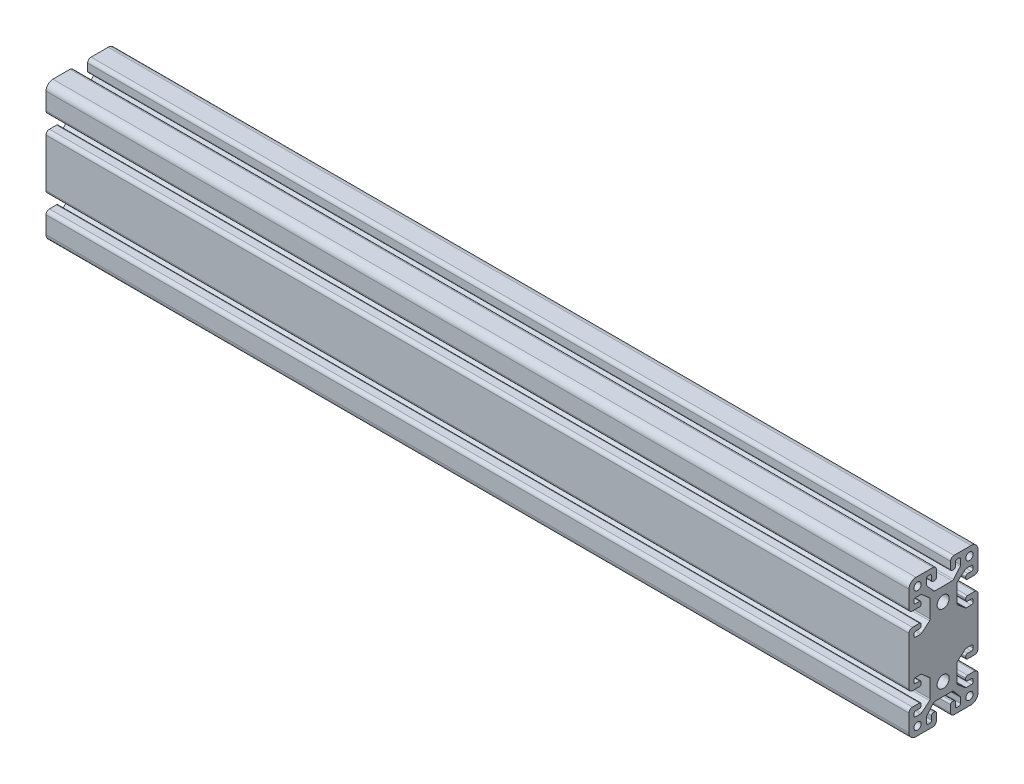
from build123d import *

# Parameters (mm, degrees)
SKETCH9_R                 = 3.5
SKETCH9_R_2               = 2.11
PERFIL80X40_80X40_1_DEPTH = 500


with BuildPart() as part:
    # Sketch9 → Perfil80x40 80X40(1) (new body)
    with BuildSketch(Plane.YZ):
        with BuildLine():
            Line((10.336613715, -12.811377082), (14.200412666, -8.24506923))
            ThreePointArc((14.200412666, -8.24506923), (14.543050952, -7.983833915), (14.963798951, -7.891011472))
            Line((14.963798951, -7.891011472), (25.036201049, -7.891011472))
            ThreePointArc((25.036201049, -7.891011472), (25.456949048, -7.983833915), (25.799587334, -8.24506923))
            Line((25.799587334, -8.24506923), (29.663386285, -12.811377082))
            ThreePointArc((29.663386285, -12.811377082), (29.838985166, -13.113361685), (29.9, -13.457319323))
            Line((29.9, -13.457319323), (29.9, -16.391011472))
            ThreePointArc((29.9, -16.391011472), (29.607106781, -17.098118253), (28.9, -17.391011472))
            Line((28.9, -17.391011472), (27.9, -17.391011472))
            ThreePointArc((27.9, -17.391011472), (27.192893219, -17.098118253), (26.9, -16.391011472))
            Line((26.9, -16.391011472), (26.9, -14.091011472))
            ThreePointArc((26.9, -14.091011472), (26.607106781, -13.383904691), (25.9, -13.091011472))
            Line((25.9, -13.091011472), (25.1, -13.091011472))
            ThreePointArc((25.1, -13.091011472), (24.392893219, -13.383904691), (24.1, -14.091011472))
            Line((24.1, -14.091011472), (24.1, -18.191011472))
            ThreePointArc((24.1, -18.191011472), (24.685786438, -19.605225034), (26.1, -20.191011472))
            Line((26.1, -20.191011472), (36, -20.191011472))
            ThreePointArc((36, -20.191011472), (38.828427125, -19.019438597), (40, -16.191011472))
            Line((40, -16.191011472), (40, -6.291011472))
            ThreePointArc((40, -6.291011472), (39.414213562, -4.87679791), (38, -4.291011472))
            Line((38, -4.291011472), (33.9, -4.291011472))
            ThreePointArc((33.9, -4.291011472), (33.192893219, -4.583904691), (32.9, -5.291011472))
            Line((32.9, -5.291011472), (32.9, -6.091011472))
            ThreePointArc((32.9, -6.091011472), (33.192893219, -6.798118253), (33.9, -7.091011472))
            Line((33.9, -7.091011472), (36.2, -7.091011472))
            ThreePointArc((36.2, -7.091011472), (36.907106781, -7.383904691), (37.2, -8.091011472))
            Line((37.2, -8.091011472), (37.2, -9.091011472))
            ThreePointArc((37.2, -9.091011472), (36.907106781, -9.798118253), (36.2, -10.091011472))
            Line((36.2, -10.091011472), (33.266307851, -10.091011472))
            ThreePointArc((33.266307851, -10.091011472), (32.922350213, -10.029996638), (32.62036561, -9.854397757))
            Line((32.62036561, -9.854397757), (28.054057759, -5.990598806))
            ThreePointArc((28.054057759, -5.990598806), (27.792822443, -5.64796052), (27.7, -5.227212521))
            Line((27.7, -5.227212521), (27.7, 4.845189577))
            ThreePointArc((27.7, 4.845189577), (27.792822443, 5.265937577), (28.054057759, 5.608575862))
            Line((28.054057759, 5.608575862), (32.62036561, 9.472374813))
            ThreePointArc((32.62036561, 9.472374813), (32.922350213, 9.647973694), (33.266307851, 9.708988528))
            Line((33.266307851, 9.708988528), (36.2, 9.708988528))
            ThreePointArc((36.2, 9.708988528), (36.907106781, 9.416095309), (37.2, 8.708988528))
            Line((37.2, 8.708988528), (37.2, 7.708988528))
            ThreePointArc((37.2, 7.708988528), (36.907106781, 7.001881747), (36.2, 6.708988528))
            Line((36.2, 6.708988528), (33.9, 6.708988528))
            ThreePointArc((33.9, 6.708988528), (33.192893219, 6.416095309), (32.9, 5.708988528))
            Line((32.9, 5.708988528), (32.9, 4.908988528))
            ThreePointArc((32.9, 4.908988528), (33.192893219, 4.201881747), (33.9, 3.908988528))
            Line((33.9, 3.908988528), (38, 3.908988528))
            ThreePointArc((38, 3.908988528), (39.414213562, 4.494774966), (40, 5.908988528))
            Line((40, 5.908988528), (40, 15.808988528))
            ThreePointArc((40, 15.808988528), (38.828427125, 18.637415653), (36, 19.808988528))
            Line((36, 19.808988528), (26.1, 19.808988528))
            ThreePointArc((26.1, 19.808988528), (24.685786438, 19.22320209), (24.1, 17.808988528))
            Line((24.1, 17.808988528), (24.1, 13.708988528))
            ThreePointArc((24.1, 13.708988528), (24.392893219, 13.001881747), (25.1, 12.708988528))
            Line((25.1, 12.708988528), (25.9, 12.708988528))
            ThreePointArc((25.9, 12.708988528), (26.607106781, 13.001881747), (26.9, 13.708988528))
            Line((26.9, 13.708988528), (26.9, 16.008988528))
            ThreePointArc((26.9, 16.008988528), (27.192893219, 16.716095309), (27.9, 17.008988528))
            Line((27.9, 17.008988528), (28.9, 17.008988528))
            ThreePointArc((28.9, 17.008988528), (29.607106781, 16.716095309), (29.9, 16.008988528))
            Line((29.9, 16.008988528), (29.9, 13.075296379))
            ThreePointArc((29.9, 13.075296379), (29.838985166, 12.731338741), (29.663386285, 12.429354138))
            Line((29.663386285, 12.429354138), (25.799587334, 7.863046287))
            ThreePointArc((25.799587334, 7.863046287), (25.456949048, 7.601810971), (25.036201049, 7.508988528))
            Line((25.036201049, 7.508988528), (14.963798951, 7.508988528))
            ThreePointArc((14.963798951, 7.508988528), (14.543050952, 7.601810971), (14.200412666, 7.863046287))
            Line((14.200412666, 7.863046287), (10.336613715, 12.429354138))
            ThreePointArc((10.336613715, 12.429354138), (10.161014834, 12.731338741), (10.1, 13.075296379))
            Line((10.1, 13.075296379), (10.1, 16.008988528))
            ThreePointArc((10.1, 16.008988528), (10.392893219, 16.716095309), (11.1, 17.008988528))
            Line((11.1, 17.008988528), (12.1, 17.008988528))
            ThreePointArc((12.1, 17.008988528), (12.807106781, 16.716095309), (13.1, 16.008988528))
            Line((13.1, 16.008988528), (13.1, 13.708988528))
            ThreePointArc((13.1, 13.708988528), (13.392893219, 13.001881747), (14.1, 12.708988528))
            Line((14.1, 12.708988528), (14.9, 12.708988528))
            ThreePointArc((14.9, 12.708988528), (15.607106781, 13.001881747), (15.9, 13.708988528))
            Line((15.9, 13.708988528), (15.9, 17.808988528))
            ThreePointArc((15.9, 17.808988528), (15.314213562, 19.22320209), (13.9, 19.808988528))
            Line((13.9, 19.808988528), (-13.9, 19.808988528))
            ThreePointArc((-13.9, 19.808988528), (-15.314213562, 19.22320209), (-15.9, 17.808988528))
            Line((-15.9, 17.808988528), (-15.9, 13.708988528))
            ThreePointArc((-15.9, 13.708988528), (-15.607106781, 13.001881747), (-14.9, 12.708988528))
            Line((-14.9, 12.708988528), (-14.1, 12.708988528))
            ThreePointArc((-14.1, 12.708988528), (-13.392893219, 13.001881747), (-13.1, 13.708988528))
            Line((-13.1, 13.708988528), (-13.1, 16.008988528))
            ThreePointArc((-13.1, 16.008988528), (-12.807106781, 16.716095309), (-12.1, 17.008988528))
            Line((-12.1, 17.008988528), (-11.1, 17.008988528))
            ThreePointArc((-11.1, 17.008988528), (-10.392893219, 16.716095309), (-10.1, 16.008988528))
            Line((-10.1, 16.008988528), (-10.1, 13.075296379))
            ThreePointArc((-10.1, 13.075296379), (-10.161014834, 12.731338741), (-10.336613715, 12.429354138))
            Line((-10.336613715, 12.429354138), (-14.200412666, 7.863046287))
            ThreePointArc((-14.200412666, 7.863046287), (-14.543050952, 7.601810971), (-14.963798951, 7.508988528))
            Line((-14.963798951, 7.508988528), (-25.036201049, 7.508988528))
            ThreePointArc((-25.036201049, 7.508988528), (-25.456949048, 7.601810971), (-25.799587334, 7.863046287))
            Line((-25.799587334, 7.863046287), (-29.663386285, 12.429354138))
            ThreePointArc((-29.663386285, 12.429354138), (-29.838985166, 12.731338741), (-29.9, 13.075296379))
            Line((-29.9, 13.075296379), (-29.9, 16.008988528))
            ThreePointArc((-29.9, 16.008988528), (-29.607106781, 16.716095309), (-28.9, 17.008988528))
            Line((-28.9, 17.008988528), (-27.9, 17.008988528))
            ThreePointArc((-27.9, 17.008988528), (-27.192893219, 16.716095309), (-26.9, 16.008988528))
            Line((-26.9, 16.008988528), (-26.9, 13.708988528))
            ThreePointArc((-26.9, 13.708988528), (-26.607106781, 13.001881747), (-25.9, 12.708988528))
            Line((-25.9, 12.708988528), (-25.1, 12.708988528))
            ThreePointArc((-25.1, 12.708988528), (-24.392893219, 13.001881747), (-24.1, 13.708988528))
            Line((-24.1, 13.708988528), (-24.1, 17.808988528))
            ThreePointArc((-24.1, 17.808988528), (-24.685786438, 19.22320209), (-26.1, 19.808988528))
            Line((-26.1, 19.808988528), (-36, 19.808988528))
            ThreePointArc((-36, 19.808988528), (-38.828427125, 18.637415653), (-40, 15.808988528))
            Line((-40, 15.808988528), (-40, 5.908988528))
            ThreePointArc((-40, 5.908988528), (-39.414213562, 4.494774966), (-38, 3.908988528))
            Line((-38, 3.908988528), (-33.9, 3.908988528))
            ThreePointArc((-33.9, 3.908988528), (-33.192893219, 4.201881747), (-32.9, 4.908988528))
            Line((-32.9, 4.908988528), (-32.9, 5.708988528))
            ThreePointArc((-32.9, 5.708988528), (-33.192893219, 6.416095309), (-33.9, 6.708988528))
            Line((-33.9, 6.708988528), (-36.2, 6.708988528))
            ThreePointArc((-36.2, 6.708988528), (-36.907106781, 7.001881747), (-37.2, 7.708988528))
            Line((-37.2, 7.708988528), (-37.2, 8.708988528))
            ThreePointArc((-37.2, 8.708988528), (-36.907106781, 9.416095309), (-36.2, 9.708988528))
            Line((-36.2, 9.708988528), (-33.266307851, 9.708988528))
            ThreePointArc((-33.266307851, 9.708988528), (-32.922350213, 9.647973694), (-32.62036561, 9.472374813))
            Line((-32.62036561, 9.472374813), (-28.054057759, 5.608575862))
            ThreePointArc((-28.054057759, 5.608575862), (-27.792822443, 5.265937577), (-27.7, 4.845189577))
            Line((-27.7, 4.845189577), (-27.7, -5.227212521))
            ThreePointArc((-27.7, -5.227212521), (-27.792822443, -5.64796052), (-28.054057759, -5.990598806))
            Line((-28.054057759, -5.990598806), (-32.62036561, -9.854397757))
            ThreePointArc((-32.62036561, -9.854397757), (-32.922350213, -10.029996638), (-33.266307851, -10.091011472))
            Line((-33.266307851, -10.091011472), (-36.2, -10.091011472))
            ThreePointArc((-36.2, -10.091011472), (-36.907106781, -9.798118253), (-37.2, -9.091011472))
            Line((-37.2, -9.091011472), (-37.2, -8.091011472))
            ThreePointArc((-37.2, -8.091011472), (-36.907106781, -7.383904691), (-36.2, -7.091011472))
            Line((-36.2, -7.091011472), (-33.9, -7.091011472))
            ThreePointArc((-33.9, -7.091011472), (-33.192893219, -6.798118253), (-32.9, -6.091011472))
            Line((-32.9, -6.091011472), (-32.9, -5.291011472))
            ThreePointArc((-32.9, -5.291011472), (-33.192893219, -4.583904691), (-33.9, -4.291011472))
            Line((-33.9, -4.291011472), (-38, -4.291011472))
            ThreePointArc((-38, -4.291011472), (-39.414213562, -4.87679791), (-40, -6.291011472))
            Line((-40, -6.291011472), (-40, -16.191011472))
            ThreePointArc((-40, -16.191011472), (-38.828427125, -19.019438597), (-36, -20.191011472))
            Line((-36, -20.191011472), (-26.1, -20.191011472))
            ThreePointArc((-26.1, -20.191011472), (-24.685786438, -19.605225034), (-24.1, -18.191011472))
            Line((-24.1, -18.191011472), (-24.1, -14.091011472))
            ThreePointArc((-24.1, -14.091011472), (-24.392893219, -13.383904691), (-25.1, -13.091011472))
            Line((-25.1, -13.091011472), (-25.9, -13.091011472))
            ThreePointArc((-25.9, -13.091011472), (-26.607106781, -13.383904691), (-26.9, -14.091011472))
            Line((-26.9, -14.091011472), (-26.9, -16.391011472))
            ThreePointArc((-26.9, -16.391011472), (-27.192893219, -17.098118253), (-27.9, -17.391011472))
            Line((-27.9, -17.391011472), (-28.9, -17.391011472))
            ThreePointArc((-28.9, -17.391011472), (-29.607106781, -17.098118253), (-29.9, -16.391011472))
            Line((-29.9, -16.391011472), (-29.9, -13.457319323))
            ThreePointArc((-29.9, -13.457319323), (-29.838985166, -13.113361685), (-29.663386285, -12.811377082))
            Line((-29.663386285, -12.811377082), (-25.799587334, -8.24506923))
            ThreePointArc((-25.799587334, -8.24506923), (-25.456949048, -7.983833915), (-25.036201049, -7.891011472))
            Line((-25.036201049, -7.891011472), (-14.963798951, -7.891011472))
            ThreePointArc((-14.963798951, -7.891011472), (-14.543050952, -7.983833915), (-14.200412666, -8.24506923))
            Line((-14.200412666, -8.24506923), (-10.336613715, -12.811377082))
            ThreePointArc((-10.336613715, -12.811377082), (-10.161014834, -13.113361685), (-10.1, -13.457319323))
            Line((-10.1, -13.457319323), (-10.1, -16.391011472))
            ThreePointArc((-10.1, -16.391011472), (-10.392893219, -17.098118253), (-11.1, -17.391011472))
            Line((-11.1, -17.391011472), (-12.1, -17.391011472))
            ThreePointArc((-12.1, -17.391011472), (-12.807106781, -17.098118253), (-13.1, -16.391011472))
            Line((-13.1, -16.391011472), (-13.1, -14.091011472))
            ThreePointArc((-13.1, -14.091011472), (-13.392893219, -13.383904691), (-14.1, -13.091011472))
            Line((-14.1, -13.091011472), (-14.9, -13.091011472))
            ThreePointArc((-14.9, -13.091011472), (-15.607106781, -13.383904691), (-15.9, -14.091011472))
            Line((-15.9, -14.091011472), (-15.9, -18.191011472))
            ThreePointArc((-15.9, -18.191011472), (-15.314213562, -19.605225034), (-13.9, -20.191011472))
            Line((-13.9, -20.191011472), (13.9, -20.191011472))
            ThreePointArc((13.9, -20.191011472), (15.314213562, -19.605225034), (15.9, -18.191011472))
            Line((15.9, -18.191011472), (15.9, -14.091011472))
            ThreePointArc((15.9, -14.091011472), (15.607106781, -13.383904691), (14.9, -13.091011472))
            Line((14.9, -13.091011472), (14.1, -13.091011472))
            ThreePointArc((14.1, -13.091011472), (13.392893219, -13.383904691), (13.1, -14.091011472))
            Line((13.1, -14.091011472), (13.1, -16.391011472))
            ThreePointArc((13.1, -16.391011472), (12.807106781, -17.098118253), (12.1, -17.391011472))
            Line((12.1, -17.391011472), (11.1, -17.391011472))
            ThreePointArc((11.1, -17.391011472), (10.392893219, -17.098118253), (10.1, -16.391011472))
            Line((10.1, -16.391011472), (10.1, -13.457319323))
            ThreePointArc((10.1, -13.457319323), (10.161014834, -13.113361685), (10.336613715, -12.811377082))
        make_face()
        with Locations((19.813777974, 0)):
            Circle(SKETCH9_R, mode=Mode.SUBTRACT)
        with Locations((-20.186222026, 0)):
            Circle(SKETCH9_R, mode=Mode.SUBTRACT)
        with Locations((35.05, -15.241011472)):
            Circle(SKETCH9_R_2, mode=Mode.SUBTRACT)
        with Locations((35.05, 14.858988528)):
            Circle(SKETCH9_R_2, mode=Mode.SUBTRACT)
        with Locations((-35.05, 14.858988528)):
            Circle(SKETCH9_R_2, mode=Mode.SUBTRACT)
        with Locations((-35.05, -15.241011472)):
            Circle(SKETCH9_R_2, mode=Mode.SUBTRACT)
    extrude(amount=PERFIL80X40_80X40_1_DEPTH)


solid = part.part
